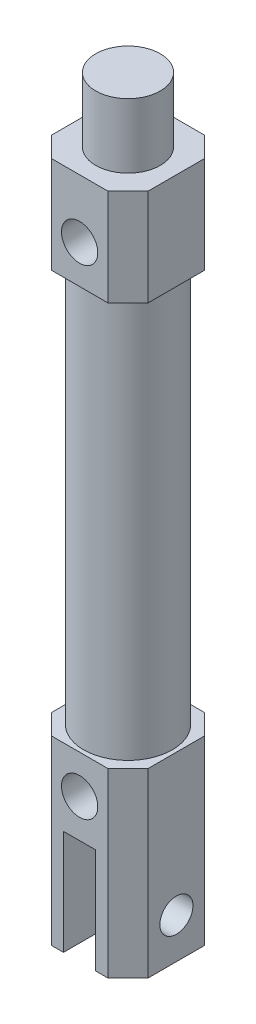
from build123d import *

# Parameters (mm, degrees)
SKETCH1_W           = 11.999999876
SKETCH1_H           = 11.999999876
BOSS_EXTRUDE1_DEPTH = 22.499999958
SKETCH2_R           = 5.499999922
BOSS_EXTRUDE2_DEPTH = 50.000000076
SKETCH3_W           = 11.999999876
SKETCH3_H           = 11.999999876
BOSS_EXTRUDE3_DEPTH = 11.999999876
SKETCH4_R           = 4.000000128
BOSS_EXTRUDE4_DEPTH = 8.000000002
CHAMFER1_SIZE       = 2.50000008
CHAMFER2_SIZE       = 2.50000008
SKETCH5_W           = 4.000000128
SKETCH5_H           = 12.999999908
CUT_EXTRUDE1_DEPTH  = 94.467908824
SKETCH6_R           = 2.049999964
CUT_EXTRUDE2_DEPTH  = 94.467908824
SKETCH7_R           = 2.250000072
CUT_EXTRUDE3_DEPTH  = 6.99999997
SKETCH8_R           = 2.250000072
CUT_EXTRUDE4_DEPTH  = 6.99999997


with BuildPart() as part:
    # Sketch1 → Boss-Extrude1 (new body)
    with BuildSketch(Plane(origin=(0, 0, 0), x_dir=(1, 0, 0), z_dir=(0, 1, 0))):
        Rectangle(SKETCH1_W, SKETCH1_H)
    extrude(amount=BOSS_EXTRUDE1_DEPTH)

    # Sketch2 → Boss-Extrude2 (add)
    with BuildSketch(Plane(origin=(0, 22.499999958, 0), x_dir=(1, 0, 0), z_dir=(0, 1, 0))):
        with Locations(Location((0, 0, 0), (0, 0, 270))):
            Circle(SKETCH2_R)
    extrude(amount=BOSS_EXTRUDE2_DEPTH)

    # Sketch3 → Boss-Extrude3 (add)
    with BuildSketch(Plane(origin=(0, 72.500000034, 0), x_dir=(1, 0, 0), z_dir=(0, 1, 0))):
        Rectangle(SKETCH3_W, SKETCH3_H)
    extrude(amount=BOSS_EXTRUDE3_DEPTH)

    # Sketch4 → Boss-Extrude4 (add)
    with BuildSketch(Plane(origin=(0, 84.49999991, 0), x_dir=(1, 0, 0), z_dir=(0, 1, 0))):
        with Locations(Location((0, 0, 0), (0, 0, 270))):
            Circle(SKETCH4_R)
    extrude(amount=BOSS_EXTRUDE4_DEPTH)

    # Chamfer1
    chamfer1_edges = [part.edges().sort_by_distance(p)[0] for p in [
        (5.999999938, 11.249999979, 5.999999938),
        (-5.999999938, 11.249999979, 5.999999938),
        (-5.999999938, 11.249999979, -5.999999938),
        (5.999999938, 11.249999979, -5.999999938),
    ]]
    chamfer(chamfer1_edges, length=CHAMFER1_SIZE)

    # Chamfer2
    chamfer2_edges = [part.edges().sort_by_distance(p)[0] for p in [
        (5.999999938, 78.499999972, 5.999999938),
        (5.999999938, 78.499999972, -5.999999938),
        (-5.999999938, 78.499999972, -5.999999938),
        (-5.999999938, 78.499999972, 5.999999938),
    ]]
    chamfer(chamfer2_edges, length=CHAMFER2_SIZE)

    # Sketch5 → Cut-Extrude1 (cut, through all)
    with BuildSketch(Plane.XY.offset(5.999999938)):
        with Locations((0, 6.499999954)):
            Rectangle(SKETCH5_W, SKETCH5_H)
    extrude(amount=-CUT_EXTRUDE1_DEPTH, mode=Mode.SUBTRACT)

    # Sketch6 → Cut-Extrude2 (cut, through all)
    with BuildSketch(Plane(origin=(5.999999938, 0, 0), x_dir=(0, 0, -1), z_dir=(1, 0, 0))):
        with Locations((0, 4.999999906)):
            Circle(SKETCH6_R)
    extrude(amount=-CUT_EXTRUDE2_DEPTH, mode=Mode.SUBTRACT)

    # Sketch7 → Cut-Extrude3 (cut)
    with BuildSketch(Plane.XY.offset(5.999999938)):
        with Locations((0, 17.749999806)):
            Circle(SKETCH7_R)
    extrude(amount=-CUT_EXTRUDE3_DEPTH, mode=Mode.SUBTRACT)

    # Sketch8 → Cut-Extrude4 (cut)
    with BuildSketch(Plane.XY.offset(5.999999938)):
        with Locations((0, 77.249999932)):
            Circle(SKETCH8_R)
    extrude(amount=-CUT_EXTRUDE4_DEPTH, mode=Mode.SUBTRACT)


solid = part.part
